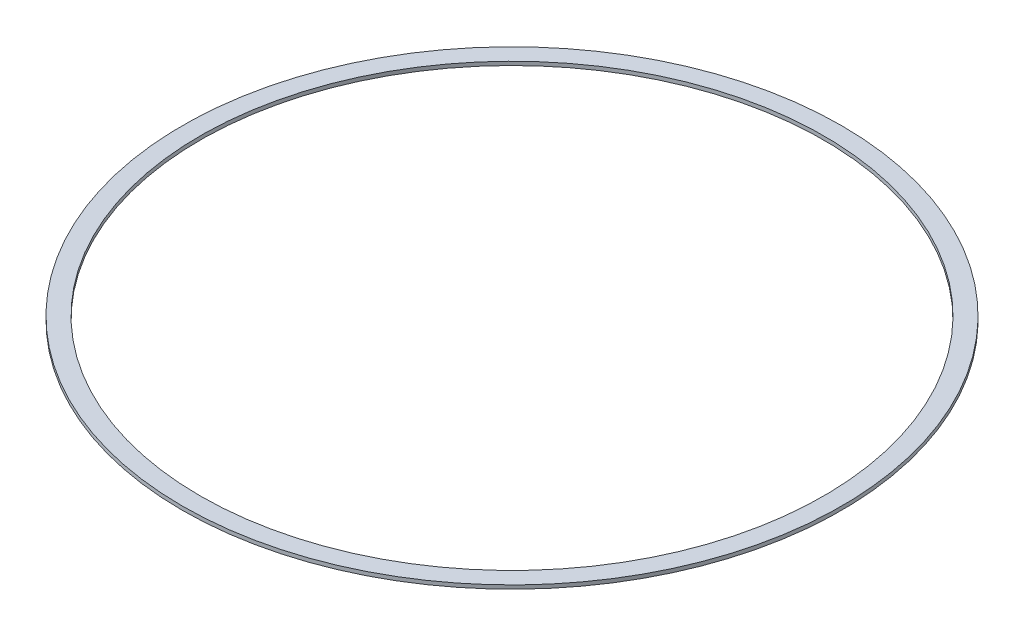
from build123d import *

# Parameters (mm, degrees)
SKETCH1_R           = 224.9678
SKETCH1_R_2         = 212.8774
BOSS_EXTRUDE1_DEPTH = 2.54


with BuildPart() as part:
    # Sketch1 → Boss-Extrude1 (new body)
    with BuildSketch(Plane(origin=(0, 0, 0), x_dir=(1, 0, 0), z_dir=(0, 1, 0))):
        with Locations(Location((0, 0, 0), (0, 0, 270))):
            Circle(SKETCH1_R)
        with Locations(Location((0, 0, 0), (0, 0, 270))):
            Circle(SKETCH1_R_2, mode=Mode.SUBTRACT)
    extrude(amount=BOSS_EXTRUDE1_DEPTH)


solid = part.part
